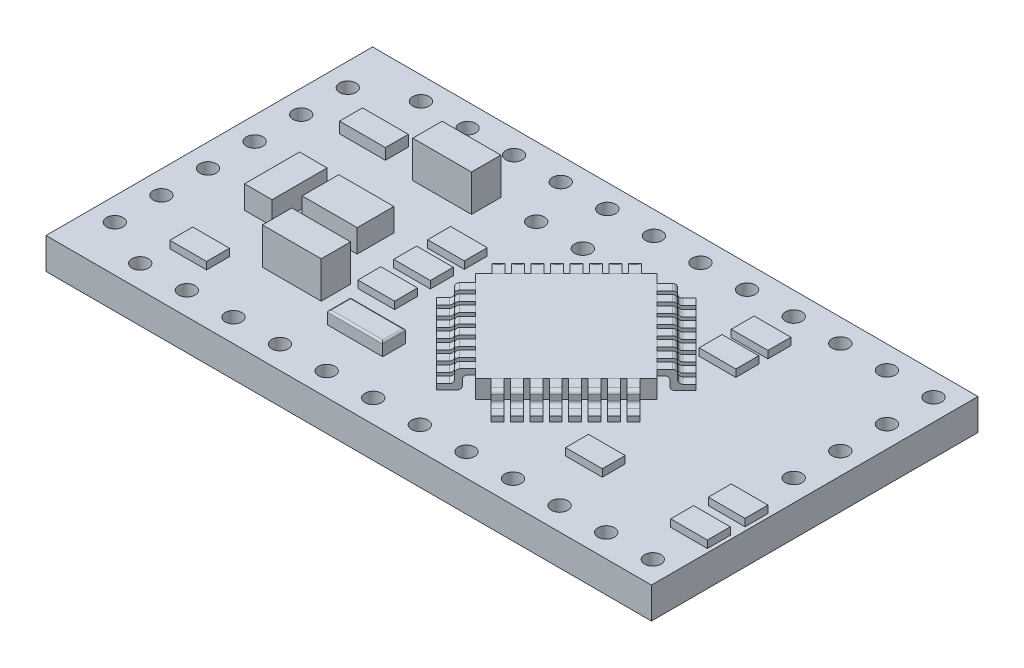
from build123d import *

# Parameters (mm, degrees)
ESBO_O1_W                   = 33
ESBO_O1_H                   = 17.8
RESSALTO_EXTRUS_O1_DEPTH    = 0.85
RESSALTO_EXTRUS_O6_DEPTH    = 1
RESSALTO_EXTRUS_O9_DEPTH    = 0.5
PADR_O_LINEAR4_COUNT        = 8
PADR_O_LINEAR4_PITCH        = 0.75
PADR_OCIRCULAR1_COUNT       = 4
ESBO_O27_W                  = 2
ESBO_O27_H                  = 1.25
RESSALTO_EXTRUS_O10_DEPTH   = 0.4
RESSALTO_EXTRUS_O10_2_DEPTH = 0.4
RESSALTO_EXTRUS_O10_3_DEPTH = 0.4
RESSALTO_EXTRUS_O10_4_DEPTH = 0.4
RESSALTO_EXTRUS_O10_5_DEPTH = 0.4
RESSALTO_EXTRUS_O10_6_DEPTH = 0.4
RESSALTO_EXTRUS_O10_7_DEPTH = 0.4
RESSALTO_EXTRUS_O10_8_DEPTH = 0.4
RESSALTO_EXTRUS_O10_9_DEPTH = 0.4
ESBO_O28_W                  = 3.2
ESBO_O28_H                  = 1.6
RESSALTO_EXTRUS_O11_DEPTH   = 2
RESSALTO_EXTRUS_O11_2_DEPTH = 2
ESBO_O29_W                  = 1.5
ESBO_O29_H                  = 3
RESSALTO_EXTRUS_O12_DEPTH   = 1.25
ESBO_O29_W_2                = 3
ESBO_O29_H_2                = 2
RESSALTO_EXTRUS_O12_2_DEPTH = 1.25
ESBO_O31_W                  = 3
ESBO_O31_H                  = 1.25
RESSALTO_EXTRUS_O14_DEPTH   = 0.7
ESBO_O32_W                  = 2.5
ESBO_O32_H                  = 1.25
RESSALTO_EXTRUS_O15_DEPTH   = 0.6
FILETE20_R                  = 0.1
ESBO_O2_R                   = 0.45
CUT_EXTRUDE_1_DEPTH         = 19.853646862


with BuildPart() as part:
    # Esboço1 → Ressalto-extrusão1 (new, symmetric)
    with BuildSketch(Plane(origin=(0, 0, 0), x_dir=(1, 0, 0), z_dir=(0, 1, 0))):
        Rectangle(ESBO_O1_W, ESBO_O1_H)
    extrude(amount=RESSALTO_EXTRUS_O1_DEPTH, both=True)

    # Esboço2 → Вырез-Вытянуть1 (cut, through all)
    with BuildSketch(Plane(origin=(0, 0.85, 0), x_dir=(1, 0, 0), z_dir=(0, 1, 0))):
        with Locations(Location((15.325, 7.65, 0), (0, 0, 270))):
            Circle(ESBO_O2_R)
        with Locations(Location((12.785, 7.65, 0), (0, 0, 270))):
            Circle(ESBO_O2_R)
        with Locations(Location((10.245, 7.65, 0), (0, 0, 270))):
            Circle(ESBO_O2_R)
        with Locations(Location((7.705, 7.65, 0), (0, 0, 270))):
            Circle(ESBO_O2_R)
        with Locations(Location((5.165, 7.65, 0), (0, 0, 270))):
            Circle(ESBO_O2_R)
        with Locations(Location((2.625, 7.65, 0), (0, 0, 270))):
            Circle(ESBO_O2_R)
        with Locations(Location((0.085, 7.65, 0), (0, 0, 270))):
            Circle(ESBO_O2_R)
        with Locations(Location((-2.455, 7.65, 0), (0, 0, 270))):
            Circle(ESBO_O2_R)
        with Locations(Location((-4.995, 7.65, 0), (0, 0, 270))):
            Circle(ESBO_O2_R)
        with Locations(Location((-7.535, 7.65, 0), (0, 0, 270))):
            Circle(ESBO_O2_R)
        with Locations(Location((-10.075, 7.65, 0), (0, 0, 270))):
            Circle(ESBO_O2_R)
        with Locations(Location((-12.615, 7.65, 0), (0, 0, 270))):
            Circle(ESBO_O2_R)
        with Locations(Location((15.325, -7.65, 0), (0, 0, 270))):
            Circle(ESBO_O2_R)
        with Locations(Location((12.785, -7.65, 0), (0, 0, 270))):
            Circle(ESBO_O2_R)
        with Locations(Location((10.245, -7.65, 0), (0, 0, 270))):
            Circle(ESBO_O2_R)
        with Locations(Location((7.705, -7.65, 0), (0, 0, 270))):
            Circle(ESBO_O2_R)
        with Locations(Location((5.165, -7.65, 0), (0, 0, 270))):
            Circle(ESBO_O2_R)
        with Locations(Location((2.625, -7.65, 0), (0, 0, 270))):
            Circle(ESBO_O2_R)
        with Locations(Location((0.085, -7.65, 0), (0, 0, 270))):
            Circle(ESBO_O2_R)
        with Locations(Location((-2.455, -7.65, 0), (0, 0, 270))):
            Circle(ESBO_O2_R)
        with Locations(Location((-4.995, -7.65, 0), (0, 0, 270))):
            Circle(ESBO_O2_R)
        with Locations(Location((-7.535, -7.65, 0), (0, 0, 270))):
            Circle(ESBO_O2_R)
        with Locations(Location((-10.075, -7.65, 0), (0, 0, 270))):
            Circle(ESBO_O2_R)
        with Locations(Location((-12.615, -7.65, 0), (0, 0, 270))):
            Circle(ESBO_O2_R)
        with Locations(Location((-15.25, -6.4, 0), (0, 0, 270))):
            Circle(ESBO_O2_R)
        with Locations(Location((-15.25, -3.86, 0), (0, 0, 270))):
            Circle(ESBO_O2_R)
        with Locations(Location((-15.25, -1.32, 0), (0, 0, 270))):
            Circle(ESBO_O2_R)
        with Locations(Location((-15.25, 1.22, 0), (0, 0, 270))):
            Circle(ESBO_O2_R)
        with Locations(Location((-15.25, 3.76, 0), (0, 0, 270))):
            Circle(ESBO_O2_R)
        with Locations(Location((-15.25, 6.3, 0), (0, 0, 270))):
            Circle(ESBO_O2_R)
        with Locations(Location((-1.25, 5.11, 0), (0, 0, 270))):
            Circle(ESBO_O2_R)
        with Locations(Location((-3.79, 5.11, 0), (0, 0, 270))):
            Circle(ESBO_O2_R)
        with Locations(Location((15.325, 5.11, 0), (0, 0, 270))):
            Circle(ESBO_O2_R)
        with Locations(Location((15.325, 2.57, 0), (0, 0, 270))):
            Circle(ESBO_O2_R)
        with Locations(Location((15.325, 0.03, 0), (0, 0, 270))):
            Circle(ESBO_O2_R)
    extrude(amount=-CUT_EXTRUDE_1_DEPTH, mode=Mode.SUBTRACT)


with BuildPart() as body_2:
    # Esboço15 → Ressalto-extrusão6 (new body)
    with BuildSketch(Plane(origin=(0, 0.85, 0), x_dir=(1, 0, 0), z_dir=(0, 1, 0))):
        Polygon((-2, 0), (2.949747468, 4.949747468), (7.899494937, 0), (2.949747468, -4.949747468), align=None)
    extrude(amount=RESSALTO_EXTRUS_O6_DEPTH)


with BuildPart() as body_3:
    # Esboço18 → Ressalto-extrusão9 (new body)
    with BuildSketch(Plane(origin=(3.5254834, 0, 3.5254834), x_dir=(0.7071067811865464, 0, -0.7071067811865488), z_dir=(0.7071067811865488, 0, 0.7071067811865464))):
        with BuildLine():
            Line((5.585786438, 1.85), (6.185786438, 1.85))
            ThreePointArc((6.185786438, 1.85), (6.327207794, 1.791421356), (6.385786438, 1.65))
            Line((6.385786438, 1.65), (6.385786438, 1.35))
            ThreePointArc((6.385786438, 1.35), (6.444365081, 1.208578644), (6.585786438, 1.15))
            Line((6.585786438, 1.15), (7.085786438, 1.15))
            Line((7.085786438, 1.15), (7.085786438, 0.85))
            Line((7.085786438, 0.85), (6.285786438, 0.85))
            ThreePointArc((6.285786438, 0.85), (6.144365081, 0.908578644), (6.085786438, 1.05))
            Line((6.085786438, 1.05), (6.085786438, 1.35))
            ThreePointArc((6.085786438, 1.35), (6.027207794, 1.491421356), (5.885786438, 1.55))
            Line((5.885786438, 1.55), (5.585786438, 1.55))
            Line((5.585786438, 1.55), (5.585786438, 1.85))
        make_face()
    extrude(amount=-RESSALTO_EXTRUS_O9_DEPTH)


with BuildPart() as padr_o_linear4_1:
    # Padrão linear4: pattern copy
    add(body_3.part.moved(Location(Vector(-0.7071067811865496, 0, -0.7071067811865456) * (1 * PADR_O_LINEAR4_PITCH))))


with BuildPart() as padr_o_linear4_2:
    # Padrão linear4: pattern copy
    add(body_3.part.moved(Location(Vector(-0.7071067811865496, 0, -0.7071067811865456) * (2 * PADR_O_LINEAR4_PITCH))))


with BuildPart() as padr_o_linear4_3:
    # Padrão linear4: pattern copy
    add(body_3.part.moved(Location(Vector(-0.7071067811865496, 0, -0.7071067811865456) * (3 * PADR_O_LINEAR4_PITCH))))


with BuildPart() as padr_o_linear4_4:
    # Padrão linear4: pattern copy
    add(body_3.part.moved(Location(Vector(-0.7071067811865496, 0, -0.7071067811865456) * (4 * PADR_O_LINEAR4_PITCH))))


with BuildPart() as padr_o_linear4_5:
    # Padrão linear4: pattern copy
    add(body_3.part.moved(Location(Vector(-0.7071067811865496, 0, -0.7071067811865456) * (5 * PADR_O_LINEAR4_PITCH))))


with BuildPart() as padr_o_linear4_6:
    # Padrão linear4: pattern copy
    add(body_3.part.moved(Location(Vector(-0.7071067811865496, 0, -0.7071067811865456) * (6 * PADR_O_LINEAR4_PITCH))))


with BuildPart() as padr_o_linear4_7:
    # Padrão linear4: pattern copy
    add(body_3.part.moved(Location(Vector(-0.7071067811865496, 0, -0.7071067811865456) * (7 * PADR_O_LINEAR4_PITCH))))


with BuildPart() as padr_ocircular1_1:
    # PadrãoCircular1: pattern copy
    add(padr_o_linear4_7.part.rotate(Axis((2.949747468, 0, 0), (0, 1, 0)), 1 * 360 / PADR_OCIRCULAR1_COUNT))


with BuildPart() as padr_ocircular1_2:
    # PadrãoCircular1: pattern copy
    add(padr_o_linear4_7.part.rotate(Axis((2.949747468, 0, 0), (0, 1, 0)), 2 * 360 / PADR_OCIRCULAR1_COUNT))


with BuildPart() as padr_ocircular1_3:
    # PadrãoCircular1: pattern copy
    add(padr_o_linear4_7.part.rotate(Axis((2.949747468, 0, 0), (0, 1, 0)), 3 * 360 / PADR_OCIRCULAR1_COUNT))


with BuildPart() as padr_ocircular1_4:
    # PadrãoCircular1: pattern copy
    add(padr_o_linear4_6.part.rotate(Axis((2.949747468, 0, 0), (0, 1, 0)), 1 * 360 / PADR_OCIRCULAR1_COUNT))


with BuildPart() as padr_ocircular1_5:
    # PadrãoCircular1: pattern copy
    add(padr_o_linear4_6.part.rotate(Axis((2.949747468, 0, 0), (0, 1, 0)), 2 * 360 / PADR_OCIRCULAR1_COUNT))


with BuildPart() as padr_ocircular1_6:
    # PadrãoCircular1: pattern copy
    add(padr_o_linear4_6.part.rotate(Axis((2.949747468, 0, 0), (0, 1, 0)), 3 * 360 / PADR_OCIRCULAR1_COUNT))


with BuildPart() as padr_ocircular1_7:
    # PadrãoCircular1: pattern copy
    add(padr_o_linear4_5.part.rotate(Axis((2.949747468, 0, 0), (0, 1, 0)), 1 * 360 / PADR_OCIRCULAR1_COUNT))


with BuildPart() as padr_ocircular1_8:
    # PadrãoCircular1: pattern copy
    add(padr_o_linear4_5.part.rotate(Axis((2.949747468, 0, 0), (0, 1, 0)), 2 * 360 / PADR_OCIRCULAR1_COUNT))


with BuildPart() as padr_ocircular1_9:
    # PadrãoCircular1: pattern copy
    add(padr_o_linear4_5.part.rotate(Axis((2.949747468, 0, 0), (0, 1, 0)), 3 * 360 / PADR_OCIRCULAR1_COUNT))


with BuildPart() as padr_ocircular1_10:
    # PadrãoCircular1: pattern copy
    add(padr_o_linear4_4.part.rotate(Axis((2.949747468, 0, 0), (0, 1, 0)), 1 * 360 / PADR_OCIRCULAR1_COUNT))


with BuildPart() as padr_ocircular1_11:
    # PadrãoCircular1: pattern copy
    add(padr_o_linear4_4.part.rotate(Axis((2.949747468, 0, 0), (0, 1, 0)), 2 * 360 / PADR_OCIRCULAR1_COUNT))


with BuildPart() as padr_ocircular1_12:
    # PadrãoCircular1: pattern copy
    add(padr_o_linear4_4.part.rotate(Axis((2.949747468, 0, 0), (0, 1, 0)), 3 * 360 / PADR_OCIRCULAR1_COUNT))


with BuildPart() as padr_ocircular1_13:
    # PadrãoCircular1: pattern copy
    add(padr_o_linear4_3.part.rotate(Axis((2.949747468, 0, 0), (0, 1, 0)), 1 * 360 / PADR_OCIRCULAR1_COUNT))


with BuildPart() as padr_ocircular1_14:
    # PadrãoCircular1: pattern copy
    add(padr_o_linear4_3.part.rotate(Axis((2.949747468, 0, 0), (0, 1, 0)), 2 * 360 / PADR_OCIRCULAR1_COUNT))


with BuildPart() as padr_ocircular1_15:
    # PadrãoCircular1: pattern copy
    add(padr_o_linear4_3.part.rotate(Axis((2.949747468, 0, 0), (0, 1, 0)), 3 * 360 / PADR_OCIRCULAR1_COUNT))


with BuildPart() as padr_ocircular1_16:
    # PadrãoCircular1: pattern copy
    add(padr_o_linear4_2.part.rotate(Axis((2.949747468, 0, 0), (0, 1, 0)), 1 * 360 / PADR_OCIRCULAR1_COUNT))


with BuildPart() as padr_ocircular1_17:
    # PadrãoCircular1: pattern copy
    add(padr_o_linear4_2.part.rotate(Axis((2.949747468, 0, 0), (0, 1, 0)), 2 * 360 / PADR_OCIRCULAR1_COUNT))


with BuildPart() as padr_ocircular1_18:
    # PadrãoCircular1: pattern copy
    add(padr_o_linear4_2.part.rotate(Axis((2.949747468, 0, 0), (0, 1, 0)), 3 * 360 / PADR_OCIRCULAR1_COUNT))


with BuildPart() as padr_ocircular1_19:
    # PadrãoCircular1: pattern copy
    add(padr_o_linear4_1.part.rotate(Axis((2.949747468, 0, 0), (0, 1, 0)), 1 * 360 / PADR_OCIRCULAR1_COUNT))


with BuildPart() as padr_ocircular1_20:
    # PadrãoCircular1: pattern copy
    add(padr_o_linear4_1.part.rotate(Axis((2.949747468, 0, 0), (0, 1, 0)), 2 * 360 / PADR_OCIRCULAR1_COUNT))


with BuildPart() as padr_ocircular1_21:
    # PadrãoCircular1: pattern copy
    add(padr_o_linear4_1.part.rotate(Axis((2.949747468, 0, 0), (0, 1, 0)), 3 * 360 / PADR_OCIRCULAR1_COUNT))


with BuildPart() as padr_ocircular1_22:
    # PadrãoCircular1: pattern copy
    add(body_3.part.rotate(Axis((2.949747468, 0, 0), (0, 1, 0)), 1 * 360 / PADR_OCIRCULAR1_COUNT))


with BuildPart() as padr_ocircular1_23:
    # PadrãoCircular1: pattern copy
    add(body_3.part.rotate(Axis((2.949747468, 0, 0), (0, 1, 0)), 2 * 360 / PADR_OCIRCULAR1_COUNT))


with BuildPart() as padr_ocircular1_24:
    # PadrãoCircular1: pattern copy
    add(body_3.part.rotate(Axis((2.949747468, 0, 0), (0, 1, 0)), 3 * 360 / PADR_OCIRCULAR1_COUNT))


with BuildPart() as body_35:
    # Esboço27 → Ressalto-extrusão10 (new body)
    with BuildSketch(Plane(origin=(0, 0.85, 0), x_dir=(1, 0, 0), z_dir=(0, 1, 0))):
        with Locations((-4.5, 1.525)):
            Rectangle(ESBO_O27_W, ESBO_O27_H)
    extrude(amount=RESSALTO_EXTRUS_O10_DEPTH)


with BuildPart() as body_36:
    # Esboço27 → Ressalto-extrus_o10 2 (new body)
    with BuildSketch(Plane(origin=(0, 0.85, 0), x_dir=(1, 0, 0), z_dir=(0, 1, 0))):
        with Locations((-4.5, -0.325)):
            Rectangle(ESBO_O27_W, ESBO_O27_H)
    extrude(amount=RESSALTO_EXTRUS_O10_2_DEPTH)


with BuildPart() as body_37:
    # Esboço27 → Ressalto-extrus_o10 3 (new body)
    with BuildSketch(Plane(origin=(0, 0.85, 0), x_dir=(1, 0, 0), z_dir=(0, 1, 0))):
        with Locations((-4.5, -2.275)):
            Rectangle(ESBO_O27_W, ESBO_O27_H)
    extrude(amount=RESSALTO_EXTRUS_O10_3_DEPTH)


with BuildPart() as body_38:
    # Esboço27 → Ressalto-extrus_o10 4 (new body)
    with BuildSketch(Plane(origin=(0, 0.85, 0), x_dir=(1, 0, 0), z_dir=(0, 1, 0))):
        with Locations((9.07, -4.525)):
            Rectangle(ESBO_O27_W, ESBO_O27_H)
    extrude(amount=RESSALTO_EXTRUS_O10_4_DEPTH)


with BuildPart() as body_39:
    # Esboço27 → Ressalto-extrus_o10 5 (new body)
    with BuildSketch(Plane(origin=(0, 0.85, 0), x_dir=(1, 0, 0), z_dir=(0, 1, 0))):
        with Locations((15.3, -2.975)):
            Rectangle(ESBO_O27_W, ESBO_O27_H)
    extrude(amount=RESSALTO_EXTRUS_O10_5_DEPTH)


with BuildPart() as body_40:
    # Esboço27 → Ressalto-extrus_o10 6 (new body)
    with BuildSketch(Plane(origin=(0, 0.85, 0), x_dir=(1, 0, 0), z_dir=(0, 1, 0))):
        with Locations((15.3, -5.025)):
            Rectangle(ESBO_O27_W, ESBO_O27_H)
    extrude(amount=RESSALTO_EXTRUS_O10_6_DEPTH)


with BuildPart() as body_41:
    # Esboço27 → Ressalto-extrus_o10 7 (new body)
    with BuildSketch(Plane(origin=(0, 0.85, 0), x_dir=(1, 0, 0), z_dir=(0, 1, 0))):
        with Locations((8, 3.825)):
            Rectangle(ESBO_O27_W, ESBO_O27_H)
    extrude(amount=RESSALTO_EXTRUS_O10_7_DEPTH)


with BuildPart() as body_42:
    # Esboço27 → Ressalto-extrus_o10 8 (new body)
    with BuildSketch(Plane(origin=(0, 0.85, 0), x_dir=(1, 0, 0), z_dir=(0, 1, 0))):
        with Locations((-11.5, -5.525)):
            Rectangle(ESBO_O27_W, ESBO_O27_H)
    extrude(amount=RESSALTO_EXTRUS_O10_8_DEPTH)


with BuildPart() as body_43:
    # Esboço27 → Ressalto-extrus_o10 9 (new body)
    with BuildSketch(Plane(origin=(0, 0.85, 0), x_dir=(1, 0, 0), z_dir=(0, 1, 0))):
        with Locations((8, 5.575)):
            Rectangle(ESBO_O27_W, ESBO_O27_H)
    extrude(amount=RESSALTO_EXTRUS_O10_9_DEPTH)


with BuildPart() as body_44:
    # Esboço28 → Ressalto-extrusão11 (new body)
    with BuildSketch(Plane(origin=(0, 0.85, 0), x_dir=(1, 0, 0), z_dir=(0, 1, 0))):
        with Locations((-7.5, 4.49)):
            Rectangle(ESBO_O28_W, ESBO_O28_H)
    extrude(amount=RESSALTO_EXTRUS_O11_DEPTH)


with BuildPart() as body_45:
    # Esboço28 → Ressalto-extrus_o11 2 (new body)
    with BuildSketch(Plane(origin=(0, 0.85, 0), x_dir=(1, 0, 0), z_dir=(0, 1, 0))):
        with Locations((-7.5, -3.7)):
            Rectangle(ESBO_O28_W, ESBO_O28_H)
    extrude(amount=RESSALTO_EXTRUS_O11_2_DEPTH)


with BuildPart() as body_46:
    # Esboço29 → Ressalto-extrusão12 (new body)
    with BuildSketch(Plane(origin=(0, 0.85, 0), x_dir=(1, 0, 0), z_dir=(0, 1, 0))):
        with Locations((-11.53, -0.8)):
            Rectangle(ESBO_O29_W, ESBO_O29_H)
    extrude(amount=RESSALTO_EXTRUS_O12_DEPTH)


with BuildPart() as body_47:
    # Esboço29 → Ressalto-extrus_o12 2 (new body)
    with BuildSketch(Plane(origin=(0, 0.85, 0), x_dir=(1, 0, 0), z_dir=(0, 1, 0))):
        with Locations((-8.64, -0.3)):
            Rectangle(ESBO_O29_W_2, ESBO_O29_H_2)
    extrude(amount=RESSALTO_EXTRUS_O12_2_DEPTH)


with BuildPart() as body_48:
    # Esboço31 → Ressalto-extrusão14 (new body)
    with BuildSketch(Plane(origin=(0, 0.85, 0), x_dir=(1, 0, 0), z_dir=(0, 1, 0))):
        with Locations((-3.1, -4.825)):
            Rectangle(ESBO_O31_W, ESBO_O31_H)
    extrude(amount=RESSALTO_EXTRUS_O14_DEPTH)

    # Filete20
    filete20_edges = [body_48.edges().sort_by_distance(p)[0] for p in [
        (-1.6, 1.55, 4.825),
        (-3.1, 1.55, 4.2),
        (-4.6, 1.55, 4.825),
        (-3.1, 1.55, 5.45),
    ]]
    fillet(filete20_edges, radius=FILETE20_R)


with BuildPart() as body_49:
    # Esboço32 → Ressalto-extrusão15 (new body)
    with BuildSketch(Plane(origin=(0, 0.85, 0), x_dir=(1, 0, 0), z_dir=(0, 1, 0))):
        with Locations((-12.05, 4.525)):
            Rectangle(ESBO_O32_W, ESBO_O32_H)
    extrude(amount=RESSALTO_EXTRUS_O15_DEPTH)


solid = Compound([part.part, body_2.part, body_3.part, padr_o_linear4_1.part, padr_o_linear4_2.part, padr_o_linear4_3.part, padr_o_linear4_4.part, padr_o_linear4_5.part, padr_o_linear4_6.part, padr_o_linear4_7.part, padr_ocircular1_1.part, padr_ocircular1_2.part, padr_ocircular1_3.part, padr_ocircular1_4.part, padr_ocircular1_5.part, padr_ocircular1_6.part, padr_ocircular1_7.part, padr_ocircular1_8.part, padr_ocircular1_9.part, padr_ocircular1_10.part, padr_ocircular1_11.part, padr_ocircular1_12.part, padr_ocircular1_13.part, padr_ocircular1_14.part, padr_ocircular1_15.part, padr_ocircular1_16.part, padr_ocircular1_17.part, padr_ocircular1_18.part, padr_ocircular1_19.part, padr_ocircular1_20.part, padr_ocircular1_21.part, padr_ocircular1_22.part, padr_ocircular1_23.part, padr_ocircular1_24.part, body_35.part, body_36.part, body_37.part, body_38.part, body_39.part, body_40.part, body_41.part, body_42.part, body_43.part, body_44.part, body_45.part, body_46.part, body_47.part, body_48.part, body_49.part])
